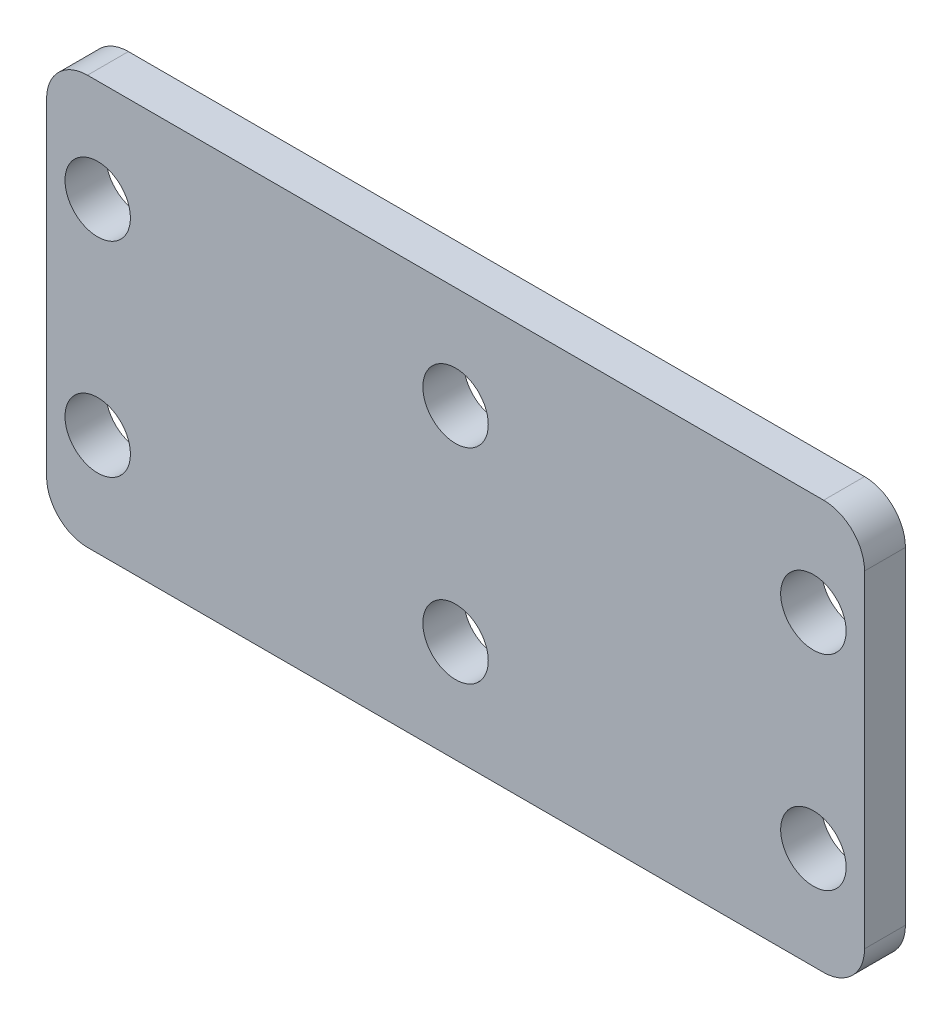
from build123d import *

# Parameters (mm, degrees)
SKETCH1_W            = 40
SKETCH1_H            = 20
BOSS_EXTRUDE1_DEPTH  = 2
M3_CLEARANCE_HOLE1_D = 3.2
FILLET1_R            = 2


with BuildPart() as part:
    # Sketch1 → Boss-Extrude1 (new body)
    with BuildSketch(Plane.XY):
        Rectangle(SKETCH1_W, SKETCH1_H)
    extrude(amount=BOSS_EXTRUDE1_DEPTH)

    # M3 Clearance Hole1 (through all)
    with Locations(Plane.XY.offset(2)):
        with Locations((17.5, -5), (-17.5, 5), (-17.5, -5), (17.5, 5), (0, 5), (0, -5)):
            Hole(M3_CLEARANCE_HOLE1_D / 2)

    # Fillet1
    fillet1_edges = [part.edges().sort_by_distance(p)[0] for p in [
        (20, -10, 1),
        (-20, -10, 1),
        (-20, 10, 1),
        (20, 10, 1),
    ]]
    fillet(fillet1_edges, radius=FILLET1_R)


solid = part.part
